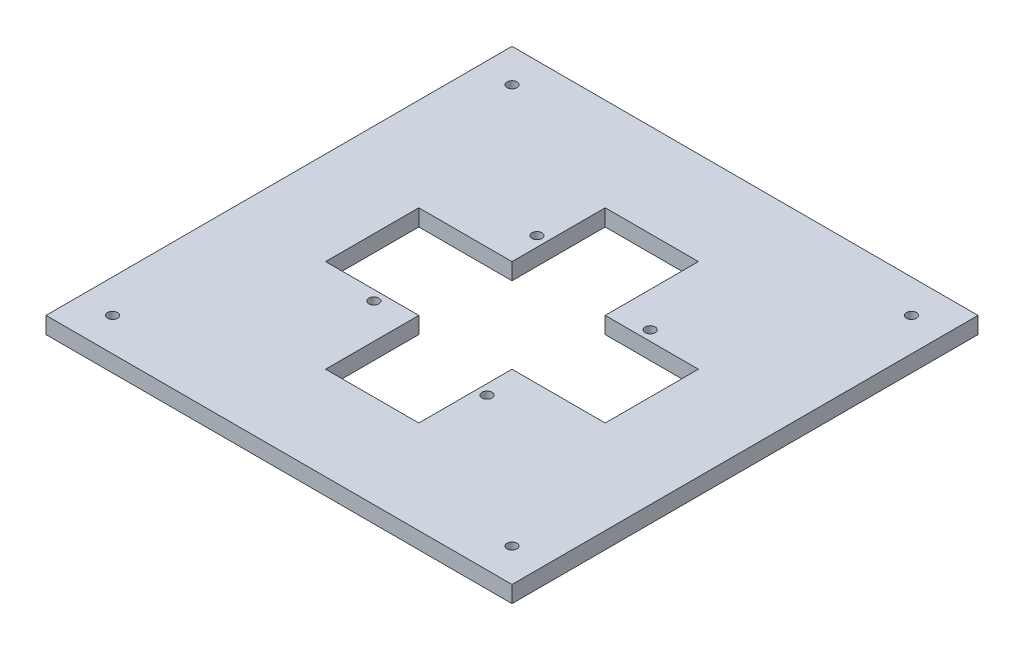
from build123d import *

# Parameters (mm, degrees)
SKETCH1_W           = 140
SKETCH1_H           = 140
BOSS_EXTRUDE1_DEPTH = 5
SKETCH2_R           = 1.5
CUT_EXTRUDE1_DEPTH  = 5
CUT_EXTRUDE2_DEPTH  = 5
SKETCH6_R           = 1.5
CUT_EXTRUDE4_DEPTH  = 5


with BuildPart() as part:
    # Sketch1 → Boss-Extrude1 (new body)
    with BuildSketch(Plane(origin=(0, 0, 0), x_dir=(1, 0, 0), z_dir=(0, 1, 0))):
        Rectangle(SKETCH1_W, SKETCH1_H)
    extrude(amount=BOSS_EXTRUDE1_DEPTH)

    # Sketch2 → Cut-Extrude1 (cut)
    with BuildSketch(Plane.XZ):
        with Locations(Location((24.505, -17.005, 0), (0, 0, 270))):
            Circle(SKETCH2_R)
        with Locations(Location((-17.005, -24.505, 0), (0, 0, 270))):
            Circle(SKETCH2_R)
        with Locations(Location((-24.505, 17.005, 0), (0, 0, 270))):
            Circle(SKETCH2_R)
        with Locations(Location((17.005, 24.505, 0), (0, 0, 270))):
            Circle(SKETCH2_R)
    extrude(amount=-CUT_EXTRUDE1_DEPTH, mode=Mode.SUBTRACT)

    # Sketch4 → Cut-Extrude2 (cut)
    with BuildSketch(Plane(origin=(0, 5, 0), x_dir=(1, 0, 0), z_dir=(0, 1, 0))):
        Polygon((-14, 42), (14, 42), (14, 14), (42, 14), (42, -14), (14, -14), (14, -42), (-14, -42), (-14, -14), (-42, -14), (-42, 14), (-14, 14), align=None)
    extrude(amount=-CUT_EXTRUDE2_DEPTH, mode=Mode.SUBTRACT)

    # Sketch6 → Cut-Extrude4 (cut)
    with BuildSketch(Plane(origin=(0, 5, 0), x_dir=(1, 0, 0), z_dir=(0, 1, 0))):
        with Locations(Location((-60, 60, 0), (0, 0, 270))):
            Circle(SKETCH6_R)
        with Locations(Location((60, 60, 0), (0, 0, 270))):
            Circle(SKETCH6_R)
        with Locations(Location((60, -60, 0), (0, 0, 270))):
            Circle(SKETCH6_R)
        with Locations(Location((-60, -60, 0), (0, 0, 270))):
            Circle(SKETCH6_R)
    extrude(amount=-CUT_EXTRUDE4_DEPTH, mode=Mode.SUBTRACT)


solid = part.part
